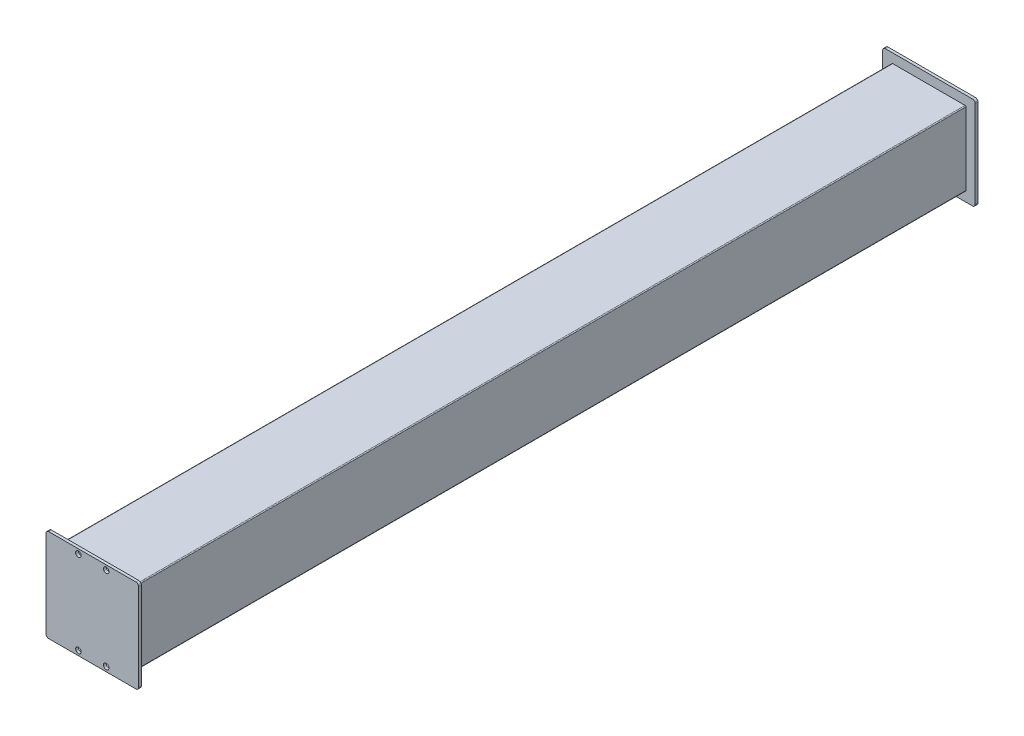
from build123d import *

# Parameters (mm, degrees)
SKETCH2_W           = 80
SKETCH2_H           = 80
SKETCH2_W_2         = 72.8
SKETCH2_H_2         = 72.8
BOSS_EXTRUDE1_DEPTH = 900
FILLET1_R           = 1
FILLET2_R           = 1
SKETCH3_W           = 100
SKETCH3_H           = 100
BOSS_EXTRUDE2_DEPTH = 3
FILLET3_R           = 3
SKETCH5_R           = 3
CUT_EXTRUDE1_DEPTH  = 3
SKETCH6_W           = 100
SKETCH6_H           = 100
BOSS_EXTRUDE3_DEPTH = 3
FILLET4_R           = 3


with BuildPart() as part:
    # Sketch2 → Boss-Extrude1 (new body)
    with BuildSketch(Plane.XY):
        Rectangle(SKETCH2_W, SKETCH2_H)
        Rectangle(SKETCH2_W_2, SKETCH2_H_2, mode=Mode.SUBTRACT)
    extrude(amount=BOSS_EXTRUDE1_DEPTH)

    # Fillet1
    fillet1_edges = [part.edges().sort_by_distance(p)[0] for p in [
        (40, -40, 450),
        (-40, -40, 450),
        (-40, 40, 450),
        (40, 40, 450),
    ]]
    fillet(fillet1_edges, radius=FILLET1_R)

    # Fillet2
    fillet2_edges = [part.edges().sort_by_distance(p)[0] for p in [
        (-36.4, 36.4, 450),
        (-36.4, -36.4, 450),
        (36.4, -36.4, 450),
        (36.4, 36.4, 450),
    ]]
    fillet(fillet2_edges, radius=FILLET2_R)

    # Sketch3 → Boss-Extrude2 (add)
    with BuildSketch(Plane.XY.offset(900)):
        Rectangle(SKETCH3_W, SKETCH3_H)
    extrude(amount=BOSS_EXTRUDE2_DEPTH)

    # Fillet3
    fillet3_edges = [part.edges().sort_by_distance(p)[0] for p in [
        (50, -50, 901.5),
        (50, 50, 901.5),
        (-50, 50, 901.5),
        (-50, -50, 901.5),
    ]]
    fillet(fillet3_edges, radius=FILLET3_R)

    # Sketch5 → Cut-Extrude1 (cut)
    with BuildSketch(Plane(origin=(0, 0, 900), x_dir=(-1, 0, 0), z_dir=(0, 0, -1))):
        with Locations((15, -45)):
            Circle(SKETCH5_R)
        with Locations((-15, -45)):
            Circle(SKETCH5_R)
        with Locations((15, 45)):
            Circle(SKETCH5_R)
        with Locations((-15, 45)):
            Circle(SKETCH5_R)
    extrude(amount=-CUT_EXTRUDE1_DEPTH, mode=Mode.SUBTRACT)

    # Sketch6 → Boss-Extrude3 (add)
    with BuildSketch(Plane(origin=(0, 0, 0), x_dir=(-1, 0, 0), z_dir=(0, 0, -1))):
        Rectangle(SKETCH6_W, SKETCH6_H)
    extrude(amount=BOSS_EXTRUDE3_DEPTH)

    # Fillet4
    fillet4_edges = [part.edges().sort_by_distance(p)[0] for p in [
        (-50, -50, -1.5),
        (-50, 50, -1.5),
        (50, 50, -1.5),
        (50, -50, -1.5),
    ]]
    fillet(fillet4_edges, radius=FILLET4_R)


solid = part.part
